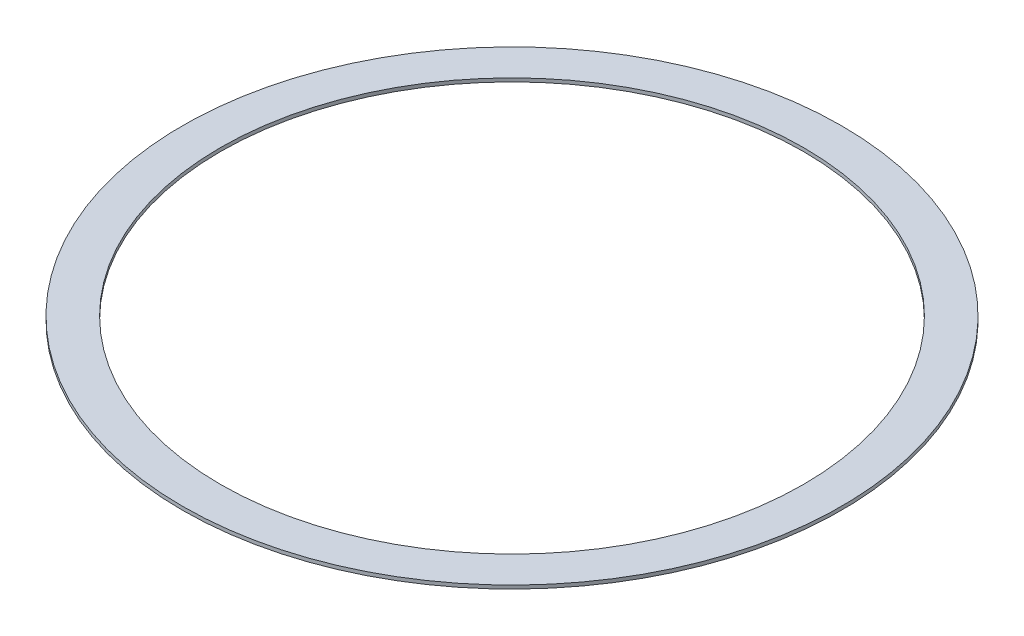
from build123d import *

# Parameters (mm, degrees)
SKETCH1_R           = 71.755
SKETCH1_R_2         = 63.5
BOSS_EXTRUDE2_DEPTH = 0.762


with BuildPart() as part:
    # Sketch1 → Boss-Extrude2 (new body)
    with BuildSketch(Plane(origin=(0, 0, 0), x_dir=(1, 0, 0), z_dir=(0, 1, 0))):
        with Locations(Location((0, 0, 0), (0, 0, 90))):
            Circle(SKETCH1_R)
        with Locations(Location((0, 0, 0), (0, 0, 90))):
            Circle(SKETCH1_R_2, mode=Mode.SUBTRACT)
    extrude(amount=BOSS_EXTRUDE2_DEPTH)


solid = part.part
